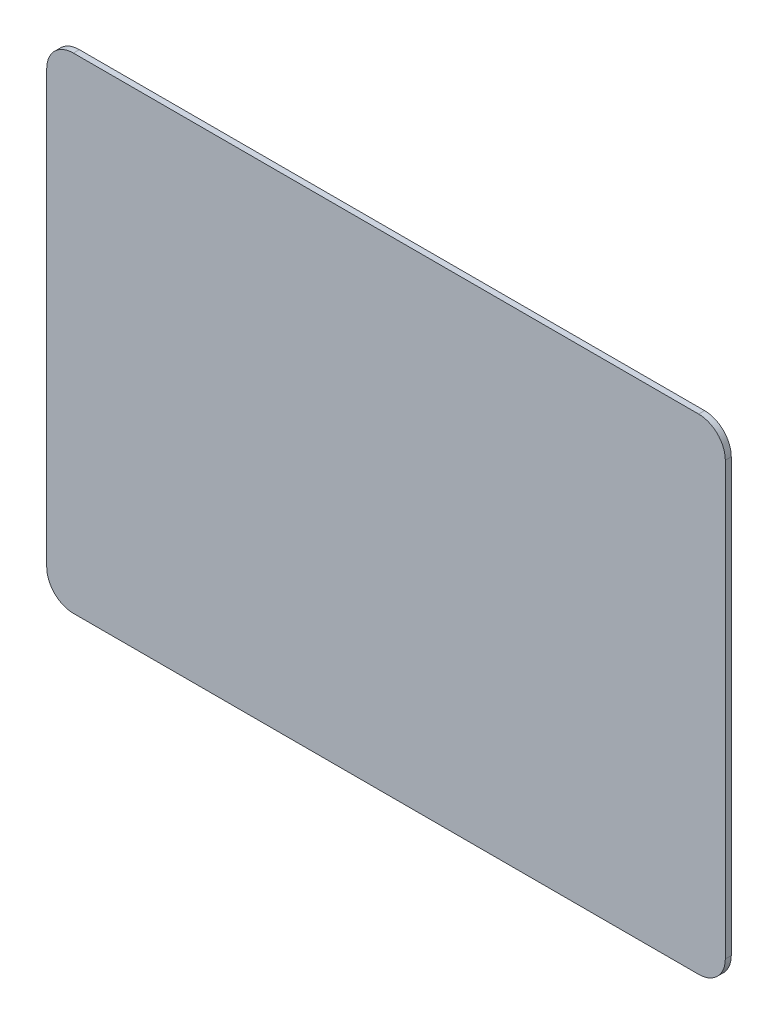
from build123d import *

# Parameters (mm, degrees)
BOSS_EXTRUDE1_DEPTH = 3.175


with BuildPart() as part:
    # Sketch1 → Boss-Extrude1 (new body)
    with BuildSketch(Plane.XY):
        with BuildLine():
            Line((-41.405944168, 34.756216238), (292.096055832, 34.756216238))
            ThreePointArc((292.096055832, 34.756216238), (302.153942688, 30.590103094), (306.320055832, 20.532216238))
            Line((306.320055832, 20.532216238), (306.320055832, -209.845783762))
            ThreePointArc((306.320055832, -209.845783762), (302.153942688, -219.903670617), (292.096055832, -224.069783762))
            Line((292.096055832, -224.069783762), (-41.405944168, -224.069783762))
            ThreePointArc((-41.405944168, -224.069783762), (-51.463831024, -219.903670617), (-55.629944168, -209.845783762))
            Line((-55.629944168, -209.845783762), (-55.629944168, 20.532216238))
            ThreePointArc((-55.629944168, 20.532216238), (-51.463831024, 30.590103094), (-41.405944168, 34.756216238))
        make_face()
    extrude(amount=-BOSS_EXTRUDE1_DEPTH)


solid = part.part
